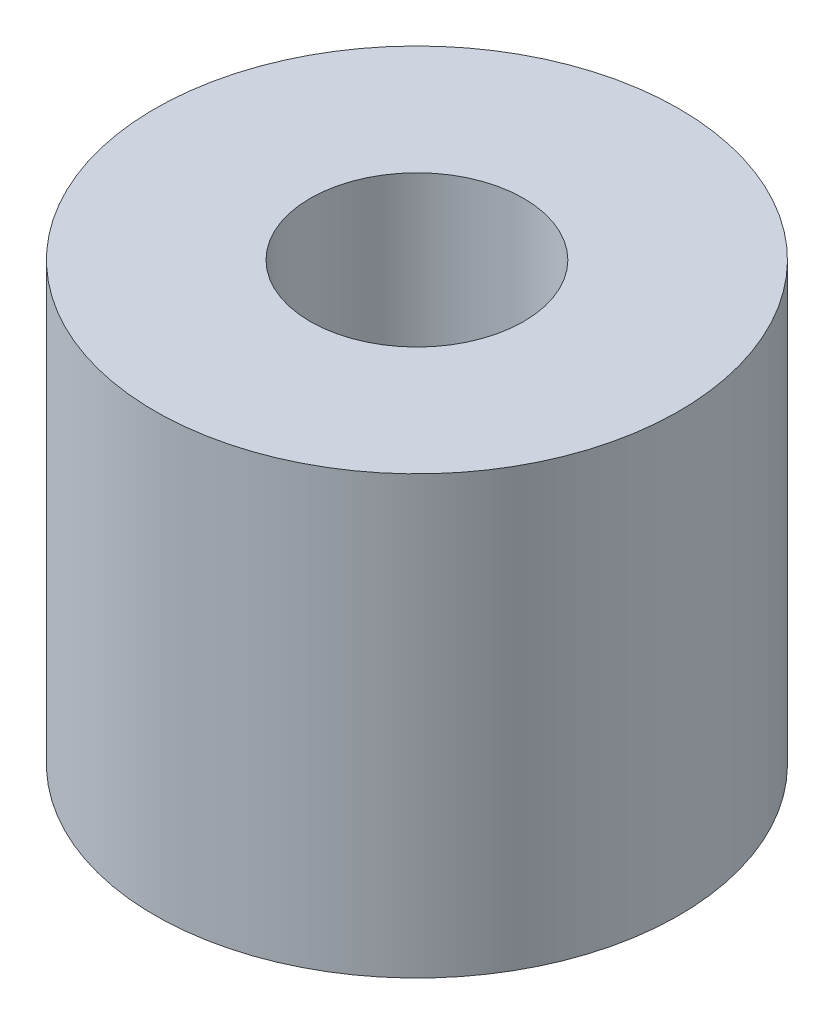
from build123d import *

# Parameters (mm, degrees)
SKETCH_1_R          = 27
EXTRUDE_1_DEPTH     = 45
SKETCH_2_R          = 11
CUT_EXTRUDE_1_DEPTH = 20
CUT_EXTRUDE_2_DEPTH = 20


with BuildPart() as part:
    # 草图1 → 凸台-拉伸1 (new body)
    with BuildSketch(Plane(origin=(0, 0, 0), x_dir=(1, 0, 0), z_dir=(0, 1, 0))):
        with Locations(Location((0, 0, 0), (0, 0, 90))):
            Circle(SKETCH_1_R)
    extrude(amount=EXTRUDE_1_DEPTH)

    # 草图2 → 切除-拉伸1 (cut)
    with BuildSketch(Plane(origin=(0, 45, 0), x_dir=(1, 0, 0), z_dir=(0, 1, 0))):
        with Locations(Location((0, 0, 0), (0, 0, 270))):
            Circle(SKETCH_2_R)
    extrude(amount=-CUT_EXTRUDE_1_DEPTH, mode=Mode.SUBTRACT)

    # 草图3 → 切除-拉伸2 (cut)
    with BuildSketch(Plane.XZ):
        with BuildLine():
            Line((-2.6, 10.2), (2.6, 10.2))
            Line((2.6, 10.2), (2.6, 6.499230724))
            ThreePointArc((2.6, 6.499230724), (0, -7), (-2.6, 6.499230724))
            Line((-2.6, 6.499230724), (-2.6, 10.2))
        make_face()
    extrude(amount=-CUT_EXTRUDE_2_DEPTH, mode=Mode.SUBTRACT)


solid = part.part
